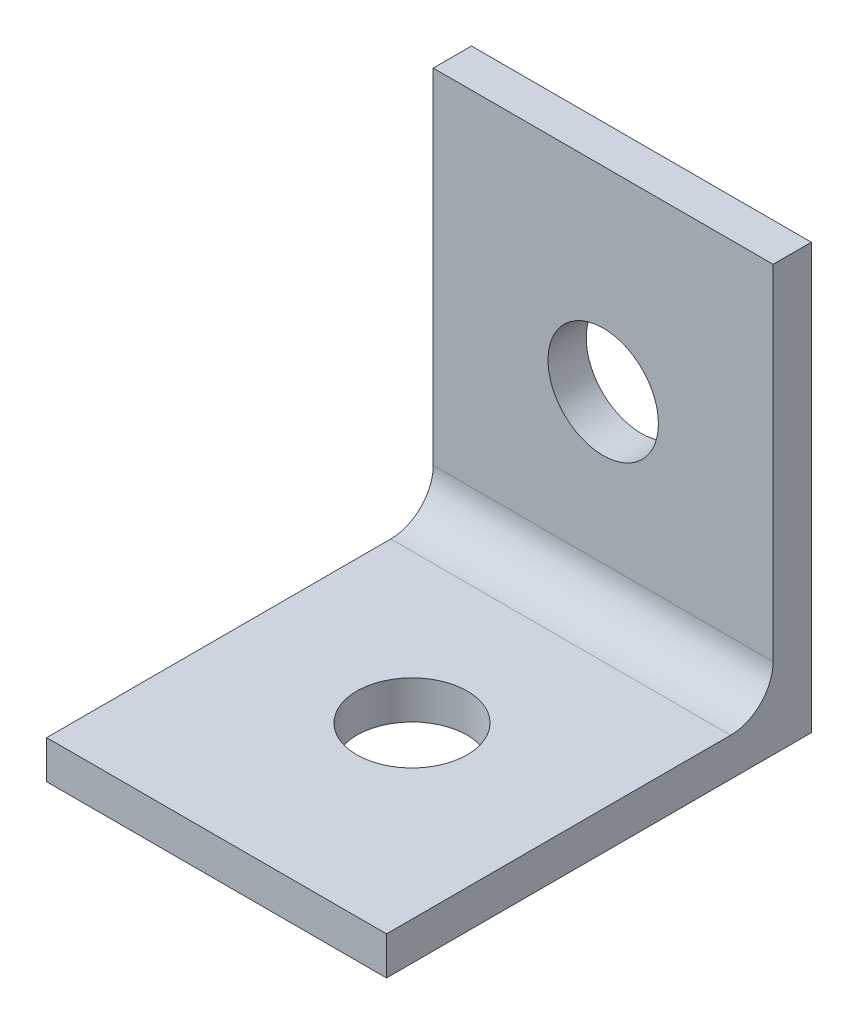
from build123d import *

# Parameters (mm, degrees)
SKETCH1_W           = 16
SKETCH1_H           = 20
BOSS_EXTRUDE1_DEPTH = 1.8
SKETCH2_W           = 16
SKETCH2_H           = 18.2
BOSS_EXTRUDE2_DEPTH = 1.8
SKETCH3_R           = 2.6
CUT_EXTRUDE1_DEPTH  = 1.8
SKETCH4_R           = 2.6
CUT_EXTRUDE2_DEPTH  = 1.8
FILLET1_R           = 2


with BuildPart() as part:
    # Sketch1 → Boss-Extrude1 (new body)
    with BuildSketch(Plane.XY):
        with Locations((8, 10)):
            Rectangle(SKETCH1_W, SKETCH1_H)
    extrude(amount=BOSS_EXTRUDE1_DEPTH)

    # Sketch2 → Boss-Extrude2 (add)
    with BuildSketch(Plane.XZ):
        with Locations((8, 10.9)):
            Rectangle(SKETCH2_W, SKETCH2_H)
    extrude(amount=-BOSS_EXTRUDE2_DEPTH)

    # Sketch3 → Cut-Extrude1 (cut)
    with BuildSketch(Plane.XY.offset(1.8)):
        with Locations((8, 10.8)):
            Circle(SKETCH3_R)
    extrude(amount=-CUT_EXTRUDE1_DEPTH, mode=Mode.SUBTRACT)

    # Sketch4 → Cut-Extrude2 (cut)
    with BuildSketch(Plane(origin=(0, 1.8, 0), x_dir=(1, 0, 0), z_dir=(0, 1, 0))):
        with Locations(Location((8, -10.8, 0), (0, 0, 270))):
            Circle(SKETCH4_R)
    extrude(amount=-CUT_EXTRUDE2_DEPTH, mode=Mode.SUBTRACT)

    # Fillet1
    fillet1_edges = [part.edges().sort_by_distance(p)[0] for p in [
        (8, 1.8, 1.8),
    ]]
    fillet(fillet1_edges, radius=FILLET1_R)


solid = part.part
